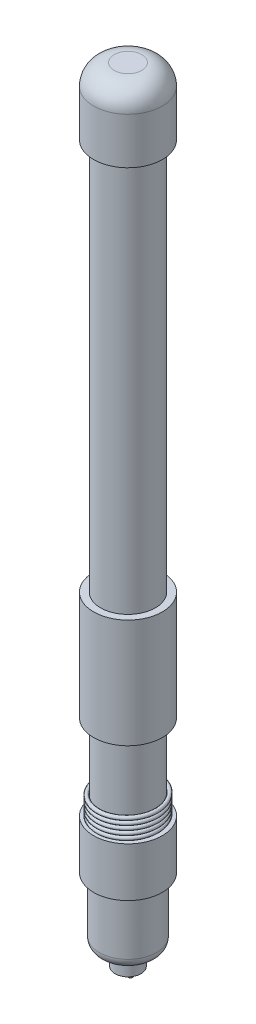
from build123d import *

# Parameters (mm, degrees)
FILLET1_R          = 10.16
FILLET2_R          = 5.08
SWEEP2_PITCH       = 2.138947368
SWEEP2_HEIGHT      = 10.16
SWEEP2_RADIUS      = 14.478
SWEEP2_START_ANGLE = -90
SKETCH3_R          = 0.9525
SKETCH6_R          = 0.381


with BuildPart() as part:
    # Sketch1 → Revolve1 (revolve)
    with BuildSketch(Plane.XY, mode=Mode.PRIVATE) as revolve1_sk:
        Polygon((0, 0), (-16.9545, 0), (-16.9545, -33.02), (-13.5255, -33.02), (-13.5255, -226.314), (-16.9545, -226.314), (-16.9545, -280.035), (-13.5255, -280.035), (-13.5255, -321.945), (-16.9545, -321.945), (-16.9545, -346.202), (-14.097, -346.202), (-14.097, -378.4092), (-6.4008, -378.4092), (-6.4008, -386.2451), (0, -386.2451), align=None)
    revolve(revolve1_sk.sketch.rotate(Axis((0, 0, 0), (0, -1, 0)), 270), axis=Axis((0, 0, 0), (0, -1, 0)))

    # Fillet1
    fillet1_edges = [part.edges().sort_by_distance(p)[0] for p in [
        (0, 0, -16.9545),
    ]]
    fillet(fillet1_edges, radius=FILLET1_R)

    # Fillet2
    fillet2_edges = [part.edges().sort_by_distance(p)[0] for p in [
        (0, -378.4092, -14.097),
    ]]
    fillet(fillet2_edges, radius=FILLET2_R)

    # Sweep3: sweep along a path in Sketch5
    with BuildLine(Plane.XY) as sweep3_path:
        Line((-2.921, -386.2451), (-2.921, -387.5151))
        ThreePointArc((-2.921, -387.5151), (0, -390.4361), (2.921, -387.5151))
        Line((2.921, -387.5151), (2.921, -386.2451))
    # Sketch6 → Sweep3 (sweep)
    with BuildSketch(Plane.XZ.offset(386.2451)):
        with Locations((-2.921, 0)):
            Circle(SKETCH6_R)
    sweep(path=sweep3_path.line)


with BuildPart() as body_2:
    # Sweep2: sweep along a helix
    with BuildLine() as sweep2_path:
        add(Helix(SWEEP2_PITCH, SWEEP2_HEIGHT, SWEEP2_RADIUS, center=(0, -321.945, 0), direction=(0, 1, 0), mode=Mode.PRIVATE).rotate(Axis((0, -321.945, 0), (0, 1, 0)), SWEEP2_START_ANGLE))
    # Sketch3 → Sweep2 (sweep)
    with BuildSketch(Plane.XY):
        with Locations((-14.478, -321.945)):
            Circle(SKETCH3_R)
    sweep(path=sweep2_path.line, is_frenet=True)


solid = Compound([part.part, body_2.part])
